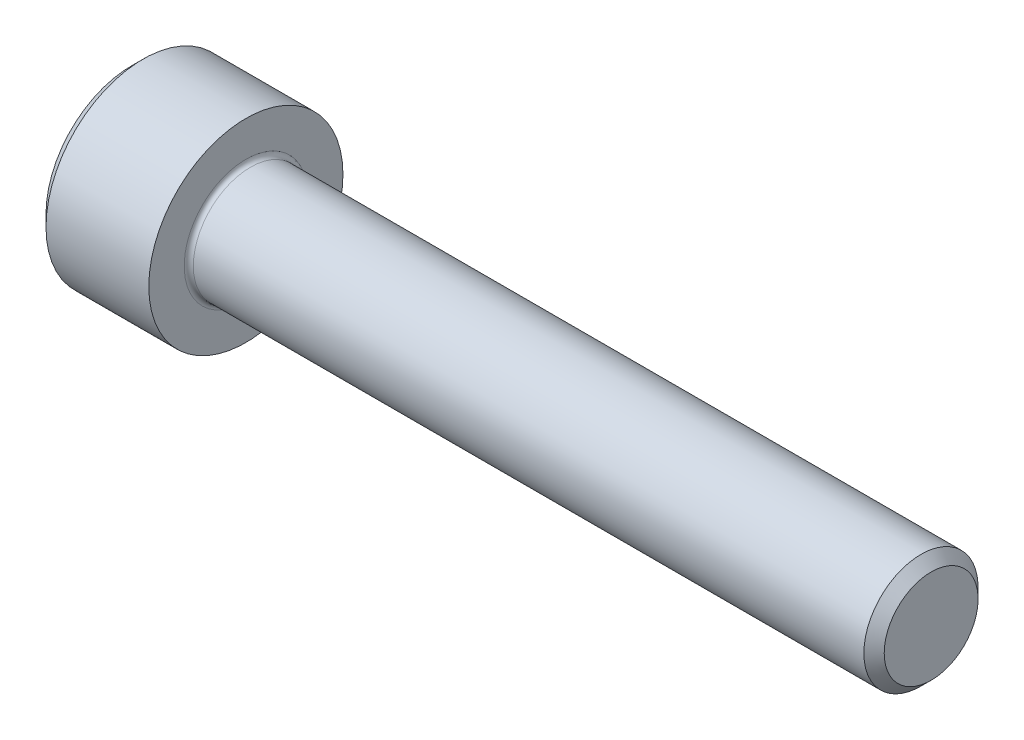
from build123d import *

# Parameters (mm, degrees)
FILLET1_R   = 0.2
HEX_2_DEPTH = 2.5


with BuildPart() as part:
    # BodySke → Base-Revolve (revolve)
    with BuildSketch(Plane.XY, mode=Mode.PRIVATE) as base_revolve_sk:
        Polygon((0, 0), (0, 3.75), (0.5, 4.25), (5, 4.25), (5, 2.5), (34.555, 2.5), (35, 2.055), (35, 0), align=None)
    revolve(base_revolve_sk.sketch.rotate(Axis((-31.75, 0, 0), (1, 0, 0)), 90), axis=Axis((-31.75, 0, 0), (1, 0, 0)))

    # Fillet1
    fillet1_edges = [part.edges().sort_by_distance(p)[0] for p in [
        (5, 0, -2.5),
    ]]
    fillet(fillet1_edges, radius=FILLET1_R)

    # Sketch2 → Hex-PreBroach (revolve, cut)
    with BuildSketch(Plane.XY, mode=Mode.PRIVATE) as hex_prebroach_sk:
        Polygon((0, 2.042), (2.5, 2.042), (3.67894925, 0), (0, 0), align=None)
    revolve(hex_prebroach_sk.sketch.rotate(Axis((0, 0, 0), (1, 0, 0)), 90), axis=Axis((0, 0, 0), (1, 0, 0)), mode=Mode.SUBTRACT)

    # Sketch3 → Hex 2 (cut)
    with BuildSketch(Plane(origin=(0, 0, 0), x_dir=(0, 0.500000000000001, 0.866025403784438), z_dir=(-1, 0, 0))):
        Polygon((1.17894925, 2.042), (-1.17894925, 2.042), (-2.357898499, 0), (-1.17894925, -2.042), (1.17894925, -2.042), (2.357898499, 0), align=None)
    extrude(amount=-HEX_2_DEPTH, mode=Mode.SUBTRACT)


solid = part.part
